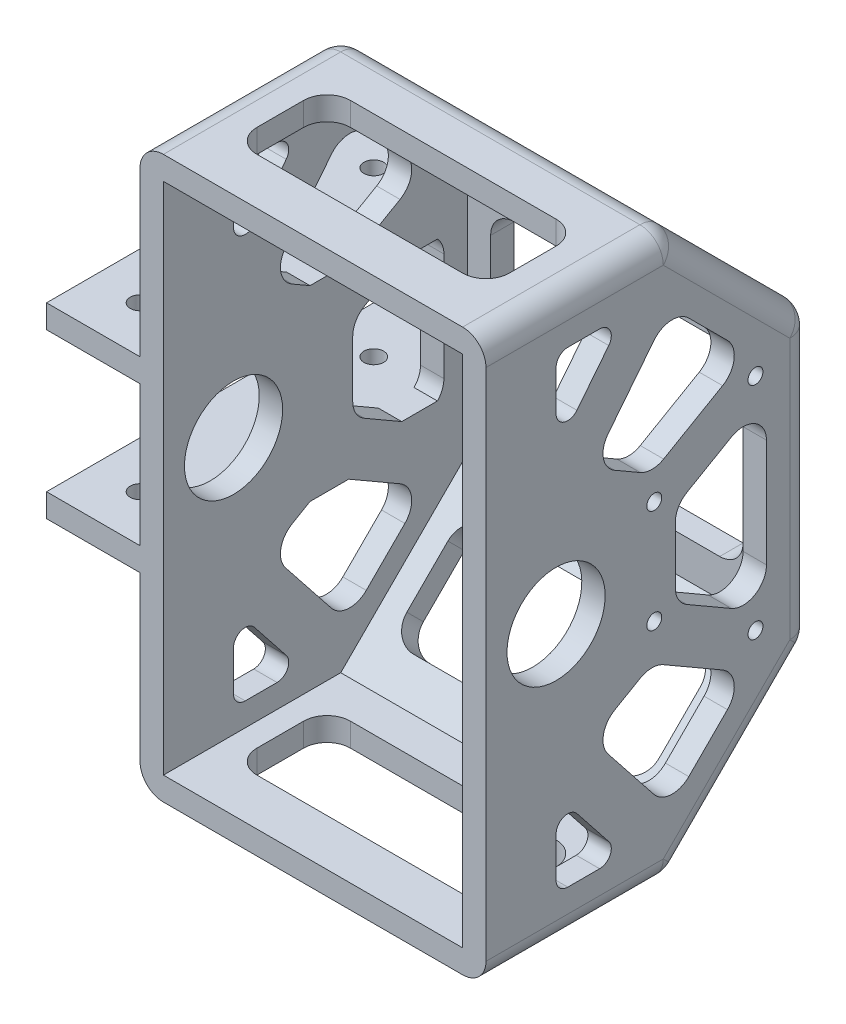
from build123d import *

# Parameters (mm, degrees)
SKETCH_1_W           = 74
SKETCH_1_H           = 120
EXTRUDE_1_DEPTH      = 70
CHAMFER_2_SIZE       = 30
SHELL_1_T            = -5
SKETCH_2_R           = 10.5
CUT_EXTRUDE_1_DEPTH  = 119.220133649
SKETCH_3_W           = 54
SKETCH_3_H           = 22.426406871
CUT_EXTRUDE_2_DEPTH  = 70
SKETCH_4_W           = 54
SKETCH_4_H           = 22.426406871
CUT_EXTRUDE_3_DEPTH  = 70
SKETCH_5_W           = 54
SKETCH_5_H           = 40
CUT_EXTRUDE_4_DEPTH  = 70
SKETCH_7_W           = 54
SKETCH_7_H           = 20
CUT_EXTRUDE_5_DEPTH  = 144.767172887
FILLET_1_R           = 5
EXTRUDE_3_DEPTH      = 20
EXTRUDE_3_DEPTH_BACK = 5
SKETCH_10_W          = 70
SKETCH_10_H          = 5
SKETCH_12_R          = 2.1
CUT_EXTRUDE_7_DEPTH  = 121.619235614
SKETCH_13_R          = 1.6
CUT_EXTRUDE_8_DEPTH  = 10
FILLET_2_R           = 2.5


with BuildPart() as part:
    # ｽｹｯﾁ1 → ﾎﾞｽ - 押し出し1 (new body)
    with BuildSketch(Plane.XY):
        Rectangle(SKETCH_1_W, SKETCH_1_H)
    extrude(amount=EXTRUDE_1_DEPTH)

    # 面取り2
    chamfer_2_edges = [part.edges().sort_by_distance(p)[0] for p in [
        (0, -60, 0),
        (0, 60, 0),
    ]]
    chamfer(chamfer_2_edges, length=CHAMFER_2_SIZE)

    # ｼｪﾙ1
    shell_1_openings = [part.faces().sort_by_distance(p)[0] for p in [
        (0, 0, 70),
    ]]
    offset(amount=SHELL_1_T, openings=shell_1_openings, kind=Kind.INTERSECTION)

    # ｽｹｯﾁ2 → ｶｯﾄ - 押し出し1 (cut, through all)
    with BuildSketch(Plane.ZY.offset(37)):
        Polygon((55, -50), (55, -31.723335715), (40.521006785, -50), align=None)
        Polygon((30.582918816, -46.440783192), (47.484677526, -25.105890275), (34.5, -17.60918321), (13.738168081, -29.596032457), align=None)
        with Locations(Location((55, 0, 0), (0, 0, 270))):
            Circle(SKETCH_2_R)
        Polygon((34.5, 17.60918321), (47.484677526, 25.105890275), (30.582918816, 46.440783192), (13.738168081, 29.596032457), align=None)
        Polygon((10, 20.207259422), (10, -20.207259422), (29.5, -8.948929172), (29.5, 8.948929172), align=None)
        Polygon((40.521006785, 50), (55, 31.723335715), (55, 50), align=None)
    extrude(amount=-CUT_EXTRUDE_1_DEPTH, mode=Mode.SUBTRACT)

    # ｽｹｯﾁ3 → ｶｯﾄ - 押し出し2 (cut)
    with BuildSketch(Plane(origin=(0, -15, -15), x_dir=(1, 0, 0), z_dir=(0, -0.7071067811865464, -0.7071067811865487))):
        with Locations((0, 42.426406872)):
            Rectangle(SKETCH_3_W, SKETCH_3_H)
    extrude(amount=-CUT_EXTRUDE_2_DEPTH, mode=Mode.SUBTRACT)

    # ｽｹｯﾁ4 → ｶｯﾄ - 押し出し3 (cut)
    with BuildSketch(Plane(origin=(0, 15, -15), x_dir=(1, 0, 0), z_dir=(0, 0.7071067811865464, -0.7071067811865487))):
        with Locations((0, -42.426406872)):
            Rectangle(SKETCH_4_W, SKETCH_4_H)
    extrude(amount=-CUT_EXTRUDE_3_DEPTH, mode=Mode.SUBTRACT)

    # ｽｹｯﾁ5 → ｶｯﾄ - 押し出し4 (cut)
    with BuildSketch(Plane(origin=(0, 0, 0), x_dir=(-1, 0, 0), z_dir=(0, 0, -1))):
        Rectangle(SKETCH_5_W, SKETCH_5_H)
    extrude(amount=-CUT_EXTRUDE_4_DEPTH, mode=Mode.SUBTRACT)

    # ｽｹｯﾁ7 → ｶｯﾄ - 押し出し5 (cut, through all)
    with BuildSketch(Plane(origin=(0, 60, 0), x_dir=(1, 0, 0), z_dir=(0, 1, 0))):
        with Locations((0, -50)):
            Rectangle(SKETCH_7_W, SKETCH_7_H)
    extrude(amount=-CUT_EXTRUDE_5_DEPTH, mode=Mode.SUBTRACT)

    # ﾌｨﾚｯﾄ1
    fillet_1_edges = [part.edges().sort_by_distance(p)[0] for p in [
        (34.5, 20.207259422, 10),
        (34.5, 8.948929172, 29.5),
        (34.5, -8.948929172, 29.5),
        (34.5, -20.207259422, 10),
        (-34.5, 20.207259422, 10),
        (-34.5, 8.948929172, 29.5),
        (-34.5, -8.948929172, 29.5),
        (-34.5, -20.207259422, 10),
        (34.5, 46.440783192, 30.582918816),
        (34.5, 25.105890275, 47.484677526),
        (34.5, 17.60918321, 34.5),
        (34.5, 29.596032457, 13.738168081),
        (-34.5, 46.440783192, 30.582918816),
        (-34.5, 25.105890275, 47.484677526),
        (-34.5, 17.60918321, 34.5),
        (-34.5, 29.596032457, 13.738168081),
        (0, 60, 30),
        (-37, 0, 0),
        (-37, -45, 15),
        (-37, 45, 15),
        (37, 0, 0),
        (0, -30, 0),
        (0, 30, 0),
        (-27, -51.161165235, 24.696699141),
        (27, -51.161165235, 24.696699141),
        (27, -35.303300859, 8.838834765),
        (-27, -35.303300859, 8.838834765),
        (37, -45, 15),
        (37, 45, 15),
        (0, -60, 30),
        (27, 51.161165235, 24.696699141),
        (-27, 51.161165235, 24.696699141),
        (-27, 35.303300859, 8.838834765),
        (27, 35.303300859, 8.838834765),
        (-27, -20, 2.5),
        (27, -20, 2.5),
        (27, 20, 2.5),
        (-27, 20, 2.5),
        (27, 57.5, 60),
        (-27, 57.5, 60),
        (-27, 57.5, 40),
        (27, 57.5, 40),
        (27, -57.5, 60),
        (-27, -57.5, 60),
        (-27, -57.5, 40),
        (27, -57.5, 40),
        (34.5, -29.596032457, 13.738168081),
        (34.5, -17.60918321, 34.5),
        (34.5, -25.105890275, 47.484677526),
        (34.5, -46.440783192, 30.582918816),
        (-34.5, -29.596032457, 13.738168081),
        (-34.5, -17.60918321, 34.5),
        (-34.5, -25.105890275, 47.484677526),
        (-34.5, -46.440783192, 30.582918816),
        (37, -60, 50),
        (-37, -60, 50),
        (-37, 60, 50),
        (37, 60, 50),
    ]]
    fillet(fillet_1_edges, radius=FILLET_1_R)

    # ｽｹｯﾁ10 → ﾎﾞｽ - 押し出し3 (add, two sides: drawn at the far end of the back side and taken through both)
    with BuildSketch(Plane.ZY.offset(37).offset(-EXTRUDE_3_DEPTH_BACK)):
        with Locations((35, 17.5)):
            Rectangle(SKETCH_10_W, SKETCH_10_H)
        with Locations((35, -17.5)):
            Rectangle(SKETCH_10_W, SKETCH_10_H)
    extrude(amount=EXTRUDE_3_DEPTH + EXTRUDE_3_DEPTH_BACK)

    # ｽｹｯﾁ12 → ｶｯﾄ - 押し出し7 (cut, through all)
    with BuildSketch(Plane.XZ.offset(20)):
        with Locations((-47, 60)):
            Circle(SKETCH_12_R)
        with Locations((-47, 10)):
            Circle(SKETCH_12_R)
    extrude(amount=-CUT_EXTRUDE_7_DEPTH, mode=Mode.SUBTRACT)

    # ｽｹｯﾁ13 → ｶｯﾄ - 押し出し8 (cut)
    with BuildSketch(Plane(origin=(37, 0, 0), x_dir=(0, 0, -1), z_dir=(1, 0, 0))):
        with Locations(Location((-12.349364905, 24.624355653, 0), (0, 0, 90))):
            Circle(SKETCH_13_R)
        with Locations(Location((-34, 12.124355653, 0), (0, 0, 90))):
            Circle(SKETCH_13_R)
        with Locations(Location((-34, -10.011106999, 0), (0, 0, 90))):
            Circle(SKETCH_13_R)
        with Locations(Location((-12.349364905, -22.511106999, 0), (0, 0, 90))):
            Circle(SKETCH_13_R)
    extrude(amount=-CUT_EXTRUDE_8_DEPTH, mode=Mode.SUBTRACT)

    # ﾌｨﾚｯﾄ2
    fillet_2_edges = [part.edges().sort_by_distance(p)[0] for p in [
        (-34.5, -31.723335715, 55),
        (-34.5, -50, 55),
        (34.5, 50, 55),
        (34.5, 31.723335715, 55),
        (34.5, 50, 40.521006785),
        (-34.5, 50, 55),
        (-34.5, 31.723335715, 55),
        (-34.5, 50, 40.521006785),
        (34.5, -50, 40.521006785),
        (34.5, -31.723335715, 55),
        (34.5, -50, 55),
        (-34.5, -50, 40.521006785),
    ]]
    fillet(fillet_2_edges, radius=FILLET_2_R)


solid = part.part
